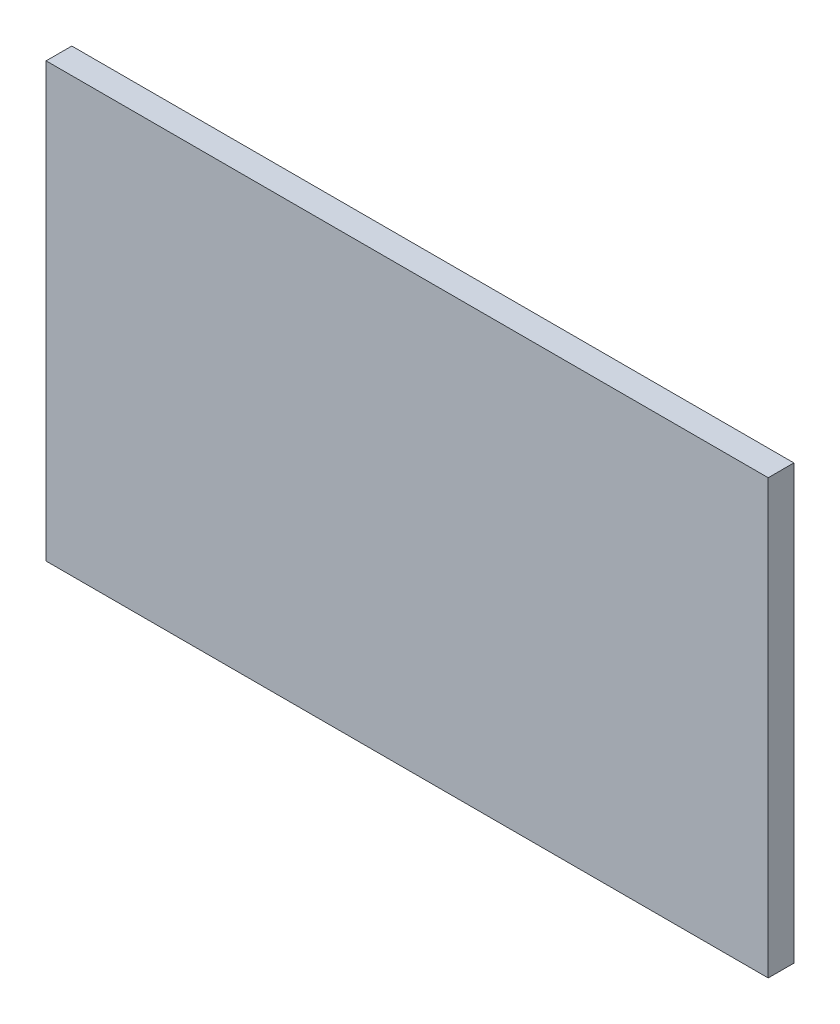
from build123d import *

# Parameters (mm, degrees)
SKETCH_1_W      = 450
SKETCH_1_H      = 270
EXTRUDE_1_DEPTH = 16


with BuildPart() as part:
    # 草图1 → 凸台-拉伸1 (new body)
    with BuildSketch(Plane.XY):
        Rectangle(SKETCH_1_W, SKETCH_1_H)
    extrude(amount=EXTRUDE_1_DEPTH)


solid = part.part
